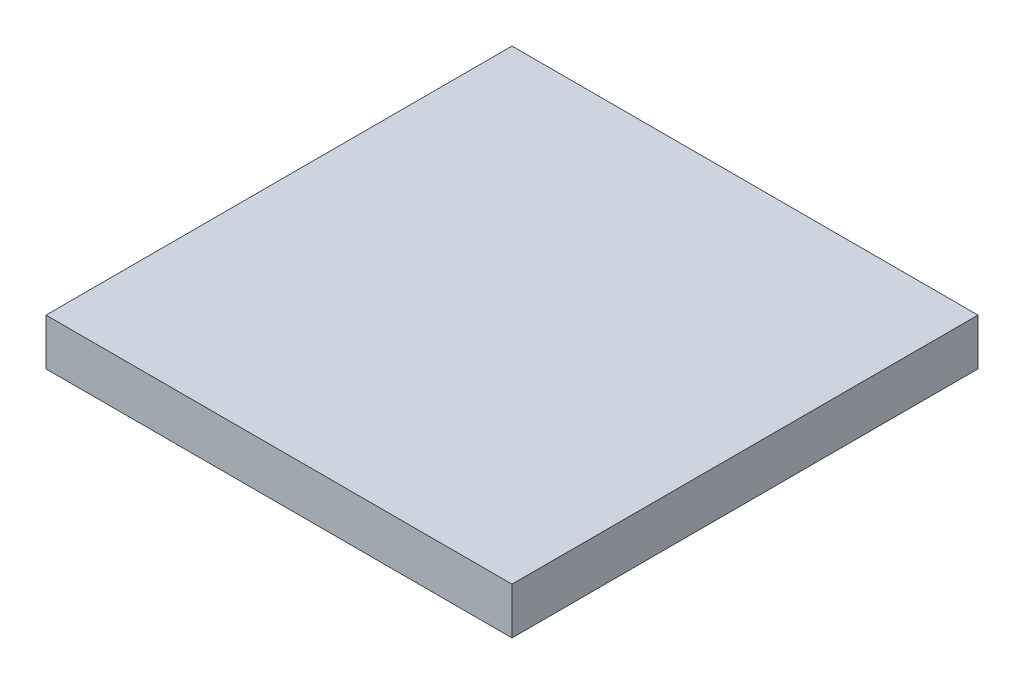
from build123d import *

# Parameters (mm, degrees)
SKETCH1_W           = 5
SKETCH1_H           = 5
BOSS_EXTRUDE1_DEPTH = 0.5


with BuildPart() as part:
    # Sketch1 → Boss-Extrude1 (new body)
    with BuildSketch(Plane(origin=(0, 0, 0), x_dir=(1, 0, 0), z_dir=(0, 1, 0))):
        with Locations((2.5, 2.5)):
            Rectangle(SKETCH1_W, SKETCH1_H)
    extrude(amount=BOSS_EXTRUDE1_DEPTH)


solid = part.part
